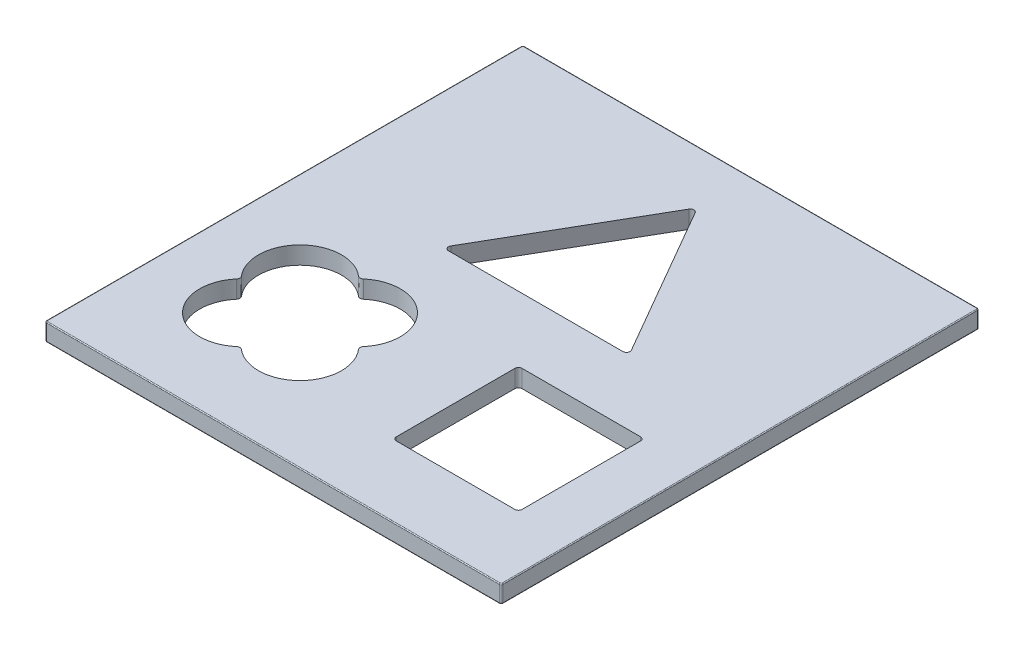
from build123d import *

# Parameters (mm, degrees)
BOSS_EXTRUDE2_DEPTH = 4.9
FILLET2_R           = 0.25
CUT_EXTRUDE1_DEPTH  = 93.078825


with BuildPart() as part:
    # Sketch1 → Boss-Extrude2 (new body)
    with BuildSketch(Plane(origin=(0, 0, 0), x_dir=(1, 0, 0), z_dir=(0, 1, 0))):
        with BuildLine():
            Line((-63, 66.5), (63, 66.5))
            ThreePointArc((63, 66.5), (63.353553391, 66.353553391), (63.5, 66))
            Line((63.5, 66), (63.5, -66))
            ThreePointArc((63.5, -66), (63.353553391, -66.353553391), (63, -66.5))
            Line((63, -66.5), (-63, -66.5))
            ThreePointArc((-63, -66.5), (-63.353553391, -66.353553391), (-63.5, -66))
            Line((-63.5, -66), (-63.5, 66))
            ThreePointArc((-63.5, 66), (-63.353553391, 66.353553391), (-63, 66.5))
        make_face()
    extrude(amount=BOSS_EXTRUDE2_DEPTH)

    # Fillet2
    fillet2_edges = [part.edges().sort_by_distance(p)[0] for p in [
        (0, 0, 66.5),
        (-63.353553391, 0, 66.353553391),
        (-63.5, 0, 0),
        (-63.353553391, 0, -66.353553391),
        (-63.353553391, 4.9, 66.353553391),
        (0, 4.9, 66.5),
        (63.353553391, 4.9, 66.353553391),
        (63.5, 4.9, 0),
        (63.353553391, 4.9, -66.353553391),
        (0, 4.9, -66.5),
        (-63.353553391, 4.9, -66.353553391),
        (0, 0, -66.5),
        (-63.5, 4.9, 0),
        (63.353553391, 0, -66.353553391),
        (63.5, 0, 0),
        (63.353553391, 0, 66.353553391),
    ]]
    fillet(fillet2_edges, radius=FILLET2_R)

    # Sketch3 → Cut-Extrude1 (cut, through all)
    with BuildSketch(Plane(origin=(0, 4.9, 0), x_dir=(1, 0, 0), z_dir=(0, 1, 0))):
        with BuildLine():
            Line((-0.866025404, 50.12), (-25.133974596, 8.086679003))
            ThreePointArc((-25.133974596, 8.086679003), (-25.133974596, 7.086679003), (-24.267949192, 6.586679003))
            Line((-24.267949192, 6.586679003), (24.267949192, 6.586679003))
            ThreePointArc((24.267949192, 6.586679003), (25.133974596, 7.086679003), (25.133974596, 8.086679003))
            Line((25.133974596, 8.086679003), (0.866025404, 50.12))
            ThreePointArc((0.866025404, 50.12), (0, 50.62), (-0.866025404, 50.12))
        make_face()
        with BuildLine():
            Line((14.3, -11.5), (47.3, -11.5))
            ThreePointArc((47.3, -11.5), (48.007106781, -11.792893219), (48.3, -12.5))
            Line((48.3, -12.5), (48.3, -45.5))
            ThreePointArc((48.3, -45.5), (48.007106781, -46.207106781), (47.3, -46.5))
            Line((47.3, -46.5), (14.3, -46.5))
            ThreePointArc((14.3, -46.5), (13.592893219, -46.207106781), (13.3, -45.5))
            Line((13.3, -45.5), (13.3, -12.5))
            ThreePointArc((13.3, -12.5), (13.592893219, -11.792893219), (14.3, -11.5))
        make_face()
        with BuildLine():
            ThreePointArc((-13.047253702, -28.349154498), (-13.65, -12.64), (-29.359154498, -12.037253702))
            ThreePointArc((-29.359154498, -12.037253702), (-30.01, -12.278043498), (-30.660845502, -12.037253702))
            ThreePointArc((-30.660845502, -12.037253702), (-46.37, -12.64), (-46.972746298, -28.349154498))
            ThreePointArc((-46.972746298, -28.349154498), (-46.731956502, -29), (-46.972746298, -29.650845502))
            ThreePointArc((-46.972746298, -29.650845502), (-46.37, -45.36), (-30.660845502, -45.962746298))
            ThreePointArc((-30.660845502, -45.962746298), (-30.01, -45.721956502), (-29.359154498, -45.962746298))
            ThreePointArc((-29.359154498, -45.962746298), (-13.65, -45.36), (-13.047253702, -29.650845502))
            ThreePointArc((-13.047253702, -29.650845502), (-13.288043498, -29), (-13.047253702, -28.349154498))
        make_face()
    extrude(amount=-CUT_EXTRUDE1_DEPTH, mode=Mode.SUBTRACT)


solid = part.part
